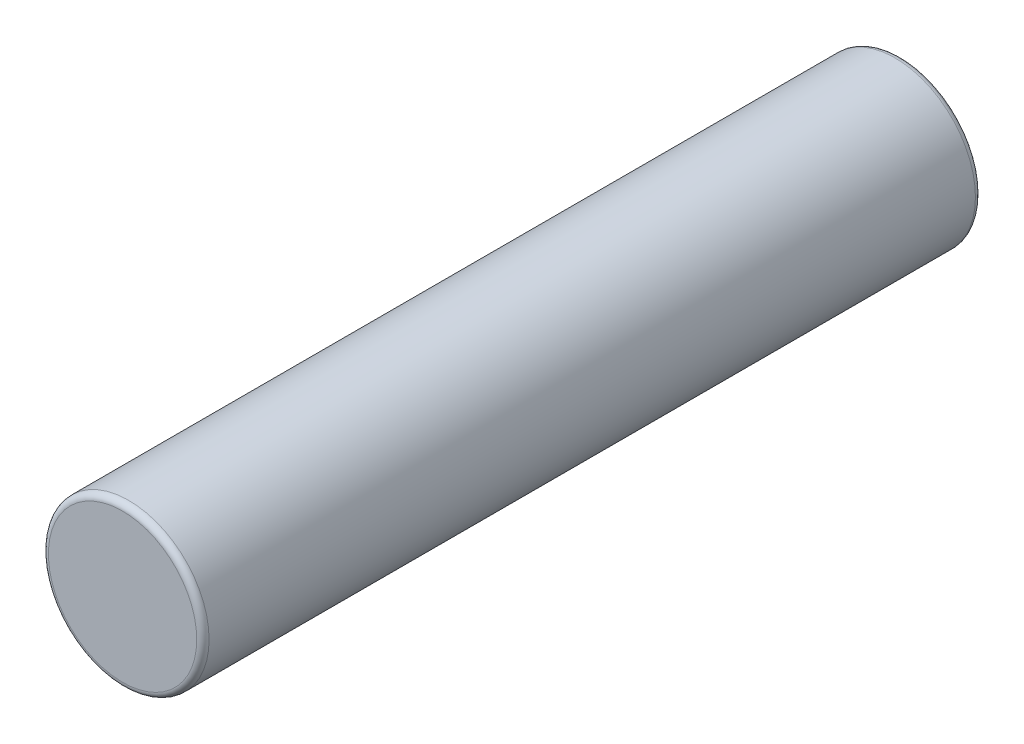
from build123d import *

# Parameters (mm, degrees)
SKETCH1_R           = 6.5
BOSS_EXTRUDE1_DEPTH = 63
FILLET1_R           = 0.5


with BuildPart() as part:
    # Sketch1 → Boss-Extrude1 (new body)
    with BuildSketch(Plane.XY):
        Circle(SKETCH1_R)
    extrude(amount=BOSS_EXTRUDE1_DEPTH)

    # Fillet1
    fillet1_edges = [part.edges().sort_by_distance(p)[0] for p in [
        (-6.5, 0, 0),
        (-6.5, 0, 63),
    ]]
    fillet(fillet1_edges, radius=FILLET1_R)


solid = part.part
